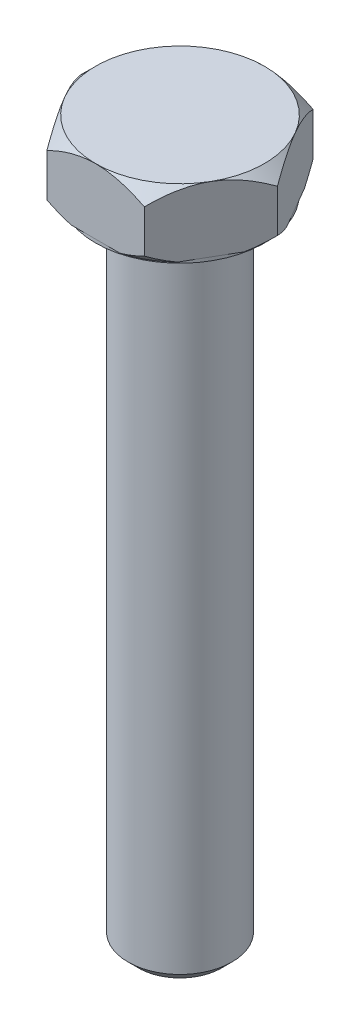
from build123d import *

# Parameters (mm, degrees)
BOSS_EXTRUDE1_DEPTH = 5.3
SKETCH2_OUTSIDE_W   = 21.122
SKETCH2_OUTSIDE_H   = 19.11
SKETCH2_OUTSIDE_R   = 6.5
CUT_EXTRUDE1_DEPTH  = 0.265
SKETCH3_R           = 4
BOSS_EXTRUDE2_DEPTH = 50
CHAMFER1_SIZE       = 0.8


with BuildPart() as part:
    # Sketch1 → Boss-Extrude1 (new body)
    with BuildSketch(Plane(origin=(0, 0, 0), x_dir=(1, 0, 0), z_dir=(0, 1, 0))):
        Polygon((7.505553499, 0), (3.75277675, 6.5), (-3.75277675, 6.5), (-7.505553499, 0), (-3.75277675, -6.5), (3.75277675, -6.5), align=None)
    extrude(amount=-BOSS_EXTRUDE1_DEPTH)

    # Sketch4 → Cut-Revolve1 (revolve, cut)
    with BuildSketch(Plane(origin=(0, 0, 0), x_dir=(0, 0, -1), z_dir=(1, 0, 0))):
        Polygon((-6.5, 0), (-8.15, 0), (-8.15, -1.65), align=None)
        Polygon((-8.15, -3.65), (-6.5, -5.3), (-8.15, -5.3), align=None)
    revolve(axis=Axis((0, 0, 0), (0, -1, 0)), mode=Mode.SUBTRACT)

    # Sketch2 outside → Cut-Extrude1 (cut)
    with BuildSketch(Plane.XZ.offset(5.3)):
        Rectangle(SKETCH2_OUTSIDE_W, SKETCH2_OUTSIDE_H)
        with Locations(Location((0, 0, 0), (0, 0, 90))):
            Circle(SKETCH2_OUTSIDE_R, mode=Mode.SUBTRACT)
    extrude(amount=-CUT_EXTRUDE1_DEPTH, mode=Mode.SUBTRACT)

    # Sketch3 → Boss-Extrude2 (add)
    with BuildSketch(Plane.XZ.offset(5.3)):
        with Locations(Location((0, 0, 0), (0, 0, 90))):
            Circle(SKETCH3_R)
    extrude(amount=BOSS_EXTRUDE2_DEPTH)

    # Chamfer1
    chamfer1_edges = [part.edges().sort_by_distance(p)[0] for p in [
        (0, -55.3, -4),
    ]]
    chamfer(chamfer1_edges, length=CHAMFER1_SIZE)


solid = part.part
